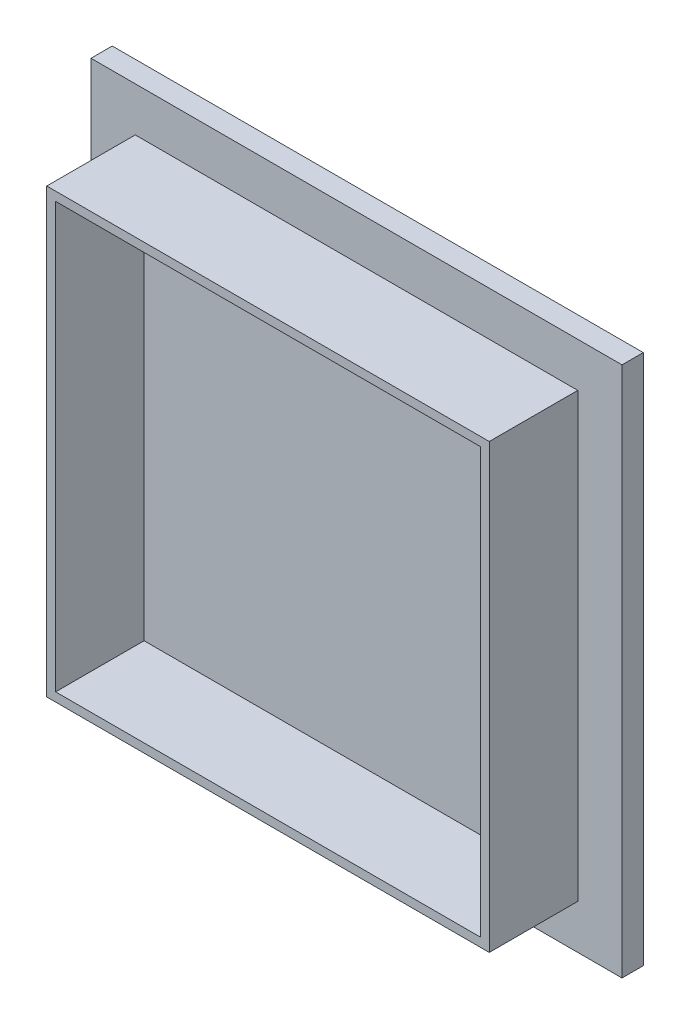
from build123d import *

# Parameters (mm, degrees)
ESQUISSE1_W             = 300
ESQUISSE1_H             = 300
BOSS_EXTRU_1_DEPTH      = 12
ESQUISSE2_W             = 250
ESQUISSE2_H             = 250
BOSS_EXTRU_2_DEPTH      = 50
ENL_V_MAT_EXTRU_1_DEPTH = 10
ENL_V_START             = -5
ESQUISSE4_W             = 55
ESQUISSE4_H             = 43.476241007
ENL_V_MAT_EXTRU_2_DEPTH = 5
ESQUISSE6_W             = 240
ESQUISSE6_H             = 240
ENL_V_MAT_EXTRU_3_DEPTH = 50


with BuildPart() as part:
    # Esquisse1 → Boss.-Extru.1 (new body)
    with BuildSketch(Plane.XY):
        Rectangle(ESQUISSE1_W, ESQUISSE1_H)
    extrude(amount=BOSS_EXTRU_1_DEPTH)

    # Esquisse2 → Boss.-Extru.2 (add)
    with BuildSketch(Plane.XY.offset(12)):
        Rectangle(ESQUISSE2_W, ESQUISSE2_H)
    extrude(amount=BOSS_EXTRU_2_DEPTH)

    # Esquisse3 → Enlèv. mat.-Extru.1 (cut)
    with BuildSketch(Plane(origin=(0, 0, 0), x_dir=(-1, 0, 0), z_dir=(0, 0, -1))):
        with BuildLine():
            Line((-15, 92.5), (15, 92.5))
            ThreePointArc((15, 92.5), (27.5, 80), (15, 67.5))
            Line((15, 67.5), (-15, 67.5))
            ThreePointArc((-15, 67.5), (-27.5, 80), (-15, 92.5))
        make_face()
    extrude(amount=-ENL_V_MAT_EXTRU_1_DEPTH, mode=Mode.SUBTRACT)

    # Esquisse4 → Enlèv. mat.-Extru.2 (cut)
    with BuildSketch(Plane(origin=(0, 0, 0), x_dir=(-1, 0, 0), z_dir=(0, 0, -1)).offset(ENL_V_START)):
        with Locations((-0.411034786, 114.238120503)):
            Rectangle(ESQUISSE4_W, ESQUISSE4_H)
    extrude(amount=-ENL_V_MAT_EXTRU_2_DEPTH, mode=Mode.SUBTRACT)

    # Esquisse6 → Enlèv. mat.-Extru.3 (cut)
    with BuildSketch(Plane.XY.offset(62)):
        Rectangle(ESQUISSE6_W, ESQUISSE6_H)
    extrude(amount=-ENL_V_MAT_EXTRU_3_DEPTH, mode=Mode.SUBTRACT)


solid = part.part
